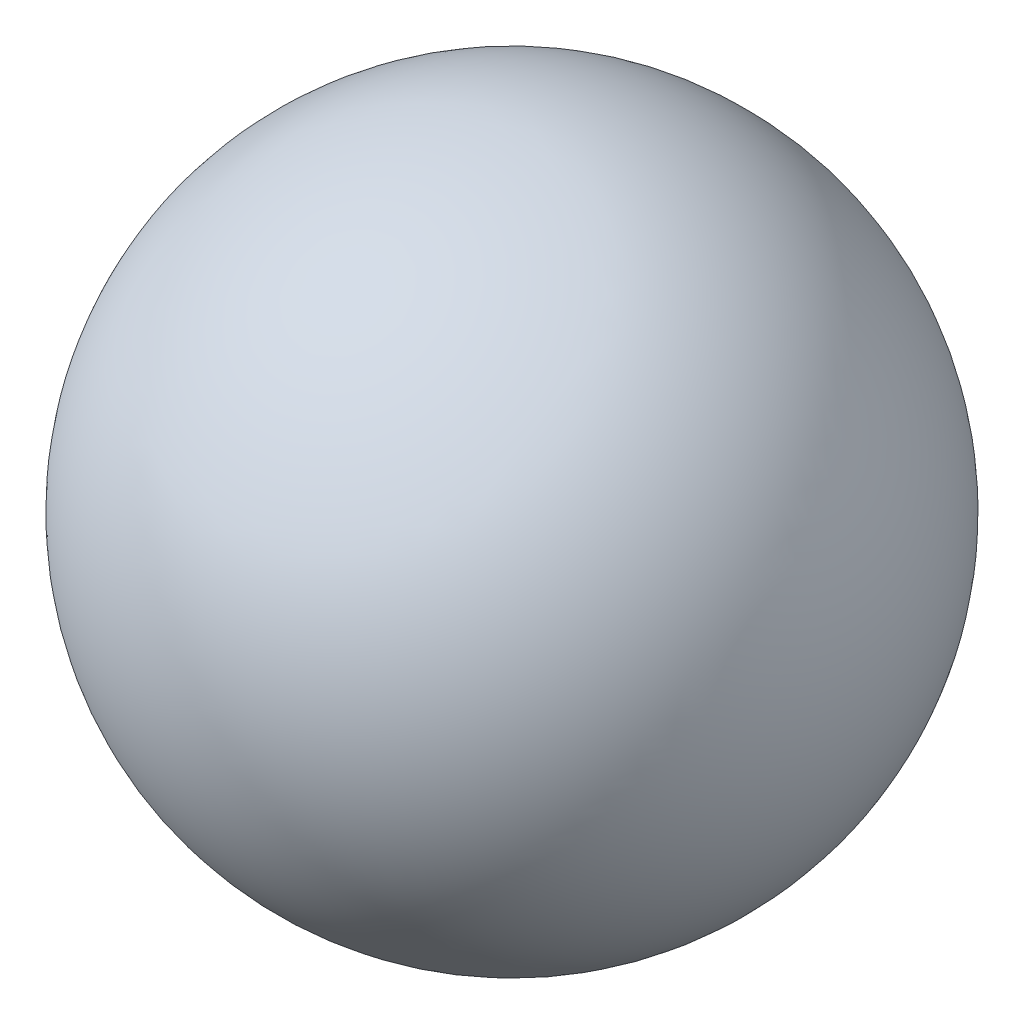
from build123d import *


with BuildPart() as part:
    # Schizzo1 → Rivoluzione1 (revolve)
    with BuildSketch(Plane.XY):
        with BuildLine():
            Line((24.5, 58.75), (3.5, 58.75))
            ThreePointArc((3.5, 58.75), (14, 69.25), (24.5, 58.75))
        make_face()
    revolve(axis=Axis((24.5, 58.75, 0), (-1, 0, 0)))


solid = part.part
